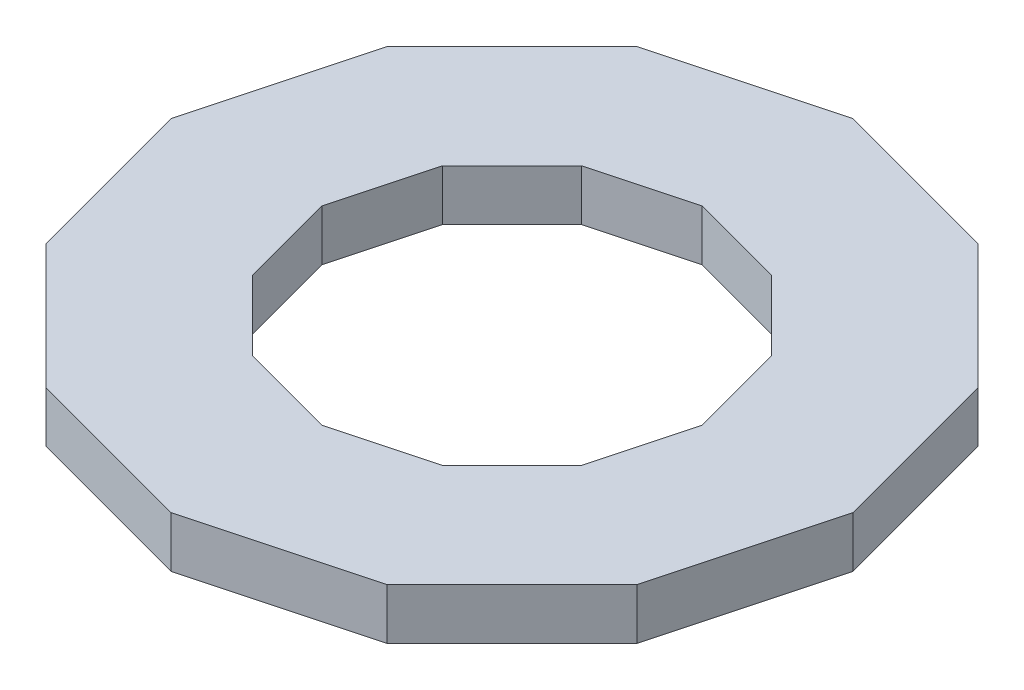
from build123d import *

# Parameters (mm, degrees)
BOSS_EXTRUDE2_DEPTH = 19.05


with BuildPart() as part:
    # Sketch2 → Boss-Extrude2 (new body)
    with BuildSketch(Plane(origin=(0, 0, 0), x_dir=(1, 0, 0), z_dir=(0, 1, 0))):
        Polygon((-127.579483136, 0), (-110.487073398, -63.789741568), (-63.789741568, -110.487073398), (0, -127.579483136), (63.789741568, -110.487073398), (110.487073398, -63.789741568), (127.579483136, 0), (110.487073398, 63.789741568), (63.789741568, 110.487073398), (0, 127.579483136), (-63.789741568, 110.487073398), (-110.487073398, 63.789741568), align=None)
        Polygon((-71.043050924, 0), (-61.525086863, -35.521525462), (-35.521525462, -61.525086863), (0, -71.043050924), (35.521525462, -61.525086863), (61.525086863, -35.521525462), (71.043050924, 0), (61.525086863, 35.521525462), (35.521525462, 61.525086863), (0, 71.043050924), (-35.521525462, 61.525086863), (-61.525086863, 35.521525462), align=None, mode=Mode.SUBTRACT)
    extrude(amount=BOSS_EXTRUDE2_DEPTH)


solid = part.part
